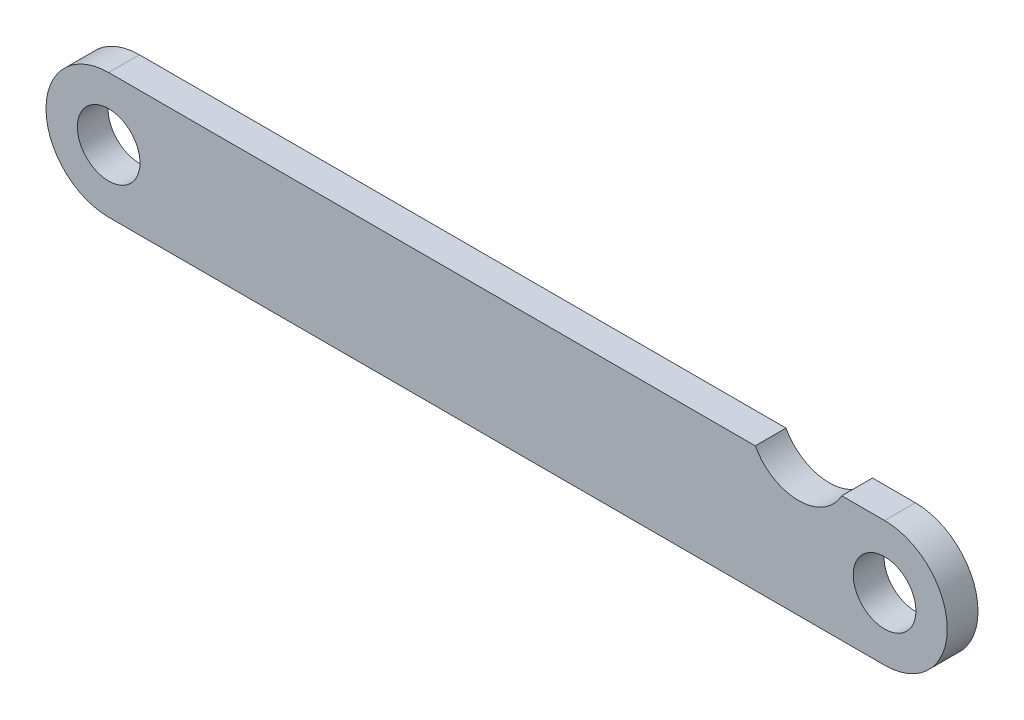
from build123d import *

# Parameters (mm, degrees)
SKETCH1_R          = 1.01901554
EXTRUDE1_DEPTH     = 1
SKETCH2_R          = 1.6
CUT_EXTRUDE2_DEPTH = 28.366693334


with BuildPart() as part:
    # Sketch1 → Extrude1 (new body)
    with BuildSketch(Plane.XY):
        with BuildLine():
            Line((0, 2.038031079), (-25.234342, 2.038031079))
            ThreePointArc((-25.234342, 2.038031079), (-27.272373079, 0), (-25.234342, -2.038031079))
            Line((-25.234342, -2.038031079), (0, -2.038031079))
            ThreePointArc((0, -2.038031079), (2.038031079, 0), (0, 2.038031079))
        make_face()
        with Locations((-25.234342, 0)):
            Circle(SKETCH1_R, mode=Mode.SUBTRACT)
        Circle(SKETCH1_R, mode=Mode.SUBTRACT)
    extrude(amount=EXTRUDE1_DEPTH)

    # Sketch2 → Cut-Extrude2 (cut, through all)
    with BuildSketch(Plane.XY):
        with Locations((-2.8, 2.8)):
            Circle(SKETCH2_R)
    extrude(amount=CUT_EXTRUDE2_DEPTH, mode=Mode.SUBTRACT)


solid = part.part
